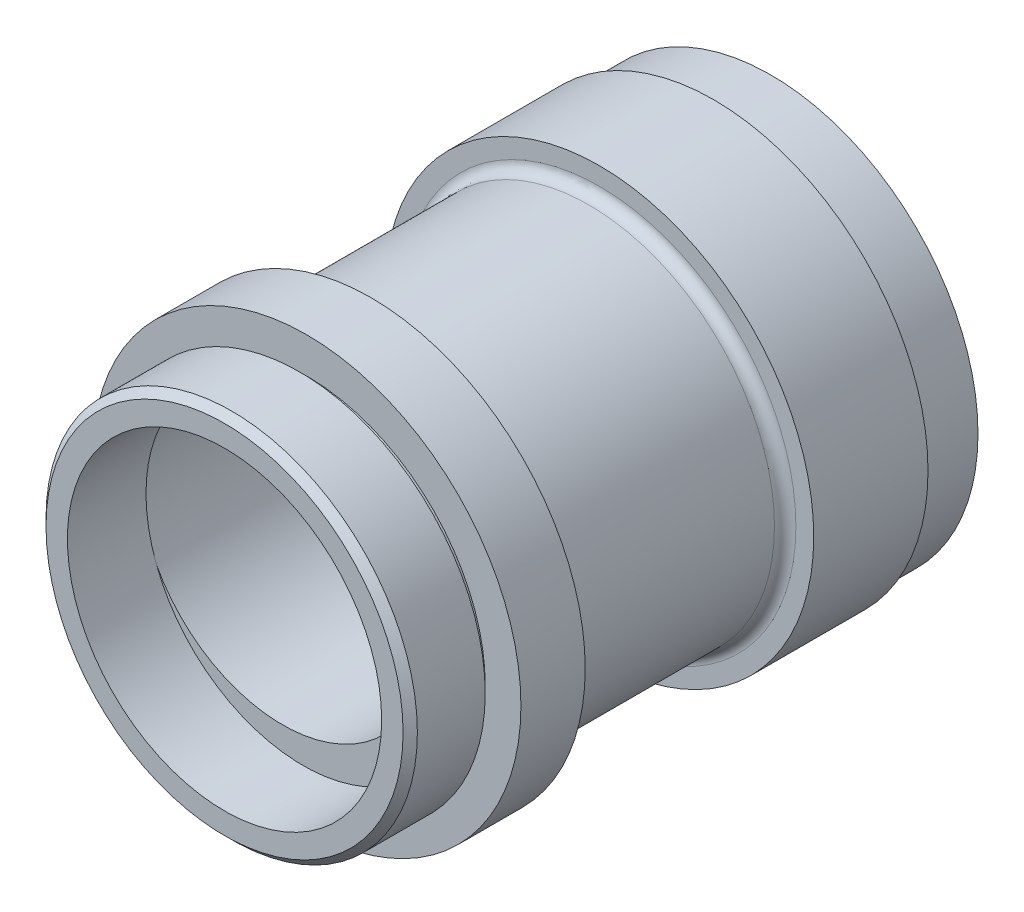
from build123d import *

# Parameters (mm, degrees)
SKETCH1_R                    = 14.5
BOSS_EXTRUDE1_DEPTH          = 4
SKETCH2_R                    = 15
BOSS_EXTRUDE2_DEPTH          = 8
SKETCH3_R                    = 13
BOSS_EXTRUDE3_DEPTH          = 16
SKETCH4_R                    = 15
BOSS_EXTRUDE4_DEPTH          = 4.5
SKETCH5_R                    = 12.5
BOSS_EXTRUDE5_DEPTH          = 0.5
SKETCH6_R                    = 13
BOSS_EXTRUDE6_DEPTH          = 5.25
SKETCH7_R                    = 11
CUT_EXTRUDE1_DEPTH           = 5.5
SKETCH8_R                    = 10
CUT_EXTRUDE2_DEPTH           = 32.75
FILLET1_R                    = 0.75
CHAMFER1_SIZE                = 0.5
F_2_0_2_DIAMETER_HOLE3_D     = 2
F_2_0_2_DIAMETER_HOLE3_DEPTH = 8.649139381
F_2_0_2_DIAMETER_HOLE3_TIP   = 0.600860619


with BuildPart() as part:
    # Sketch1 → Boss-Extrude1 (new body)
    with BuildSketch(Plane.XY):
        Circle(SKETCH1_R)
    extrude(amount=BOSS_EXTRUDE1_DEPTH)

    # Sketch2 → Boss-Extrude2 (add)
    with BuildSketch(Plane.XY.offset(4)):
        Circle(SKETCH2_R)
    extrude(amount=BOSS_EXTRUDE2_DEPTH)

    # Sketch3 → Boss-Extrude3 (add)
    with BuildSketch(Plane.XY.offset(12)):
        Circle(SKETCH3_R)
    extrude(amount=BOSS_EXTRUDE3_DEPTH)

    # Sketch4 → Boss-Extrude4 (add)
    with BuildSketch(Plane.XY.offset(28)):
        Circle(SKETCH4_R)
    extrude(amount=BOSS_EXTRUDE4_DEPTH)

    # Sketch5 → Boss-Extrude5 (add)
    with BuildSketch(Plane.XY.offset(32.5)):
        Circle(SKETCH5_R)
    extrude(amount=BOSS_EXTRUDE5_DEPTH)

    # Sketch6 → Boss-Extrude6 (add)
    with BuildSketch(Plane.XY.offset(33)):
        Circle(SKETCH6_R)
    extrude(amount=BOSS_EXTRUDE6_DEPTH)

    # Sketch7 → Cut-Extrude1 (cut)
    with BuildSketch(Plane.XY.offset(38.25)):
        Circle(SKETCH7_R)
    extrude(amount=-CUT_EXTRUDE1_DEPTH, mode=Mode.SUBTRACT)

    # Sketch8 → Cut-Extrude2 (cut)
    with BuildSketch(Plane.XY.offset(32.75)):
        with Locations((-1.44, 0.75)):
            Circle(SKETCH8_R)
    extrude(amount=-CUT_EXTRUDE2_DEPTH, mode=Mode.SUBTRACT)

    # Fillet1
    fillet1_edges = [part.edges().sort_by_distance(p)[0] for p in [
        (-13, 0, 12),
        (-13, 0, 28),
    ]]
    fillet(fillet1_edges, radius=FILLET1_R)

    # Chamfer1
    chamfer1_edges = [part.edges().sort_by_distance(p)[0] for p in [
        (-13, 0, 38.25),
    ]]
    chamfer(chamfer1_edges, length=CHAMFER1_SIZE)

    # Ø2.0 (2) Diameter Hole3
    with Locations(Plane(origin=(0, 0, 0), x_dir=(-1, 0, 0), z_dir=(0, 0, -1))):
        with Locations((-9.5, 8.8)):
            Hole(F_2_0_2_DIAMETER_HOLE3_D / 2, depth=F_2_0_2_DIAMETER_HOLE3_DEPTH)
            with Locations((0, 0, -(F_2_0_2_DIAMETER_HOLE3_DEPTH + F_2_0_2_DIAMETER_HOLE3_TIP / 2))):  # 118° drill point
                Cone(0, F_2_0_2_DIAMETER_HOLE3_D / 2, F_2_0_2_DIAMETER_HOLE3_TIP, mode=Mode.SUBTRACT)


solid = part.part
